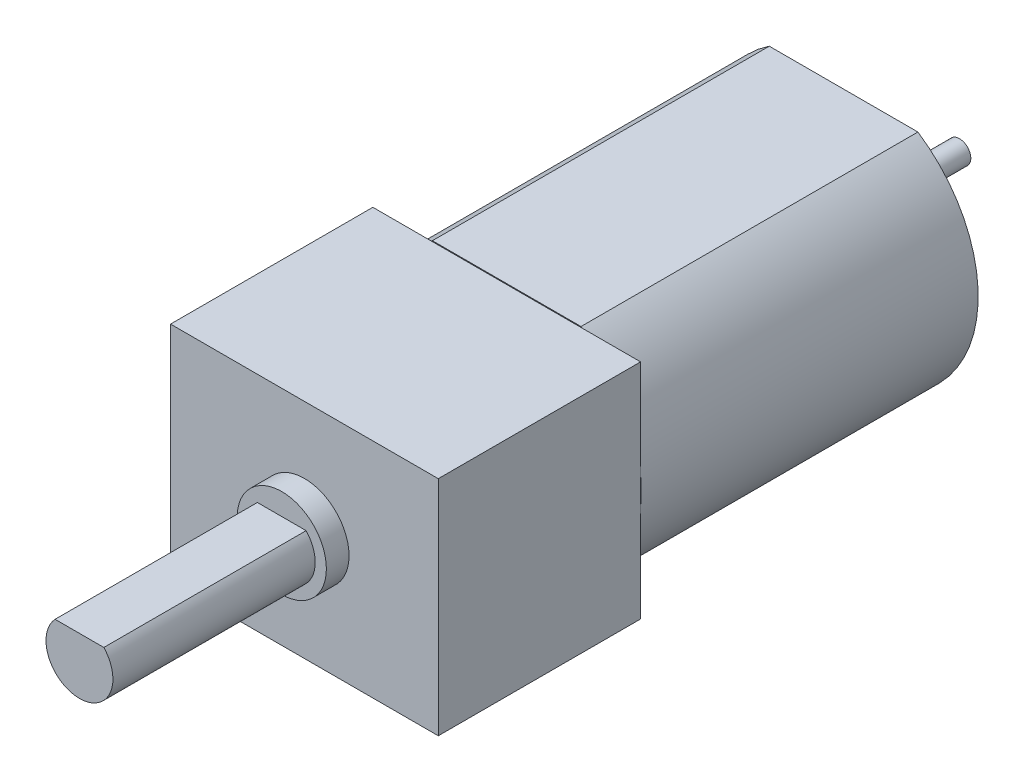
from build123d import *

# Parameters (mm, degrees)
SKETCH1_W            = 12.0015
SKETCH1_H            = 9.9822
BOSS_EXTRUDE4_DEPTH  = 9.0678
BOSS_EXTRUDE5_DEPTH  = 15.1003
SKETCH4_R            = 2.00025
BOSS_EXTRUDE9_DEPTH  = 1.016
BOSS_EXTRUDE10_DEPTH = 9.0678
SKETCH6_R            = 2.5146
BOSS_EXTRUDE11_DEPTH = 0.889
SKETCH7_R            = 0.508
BOSS_EXTRUDE12_DEPTH = 4.3053


with BuildPart() as part:
    # Sketch1 → Boss-Extrude4 (new body)
    with BuildSketch(Plane.XY):
        with Locations((11.58762082, -8.953965436)):
            Rectangle(SKETCH1_W, SKETCH1_H)
    extrude(amount=BOSS_EXTRUDE4_DEPTH)

    # Sketch3 → Boss-Extrude5 (add)
    with BuildSketch(Plane(origin=(0, 0, 0), x_dir=(-1, 0, 0), z_dir=(0, 0, -1))):
        with BuildLine():
            Line((-14.919017466, -3.924765436), (-8.256224175, -3.924765436))
            ThreePointArc((-8.256224175, -3.924765436), (-5.55512082, -8.953965436), (-8.256224175, -13.983165436))
            Line((-8.256224175, -13.983165436), (-14.919017466, -13.983165436))
            ThreePointArc((-14.919017466, -13.983165436), (-17.62012082, -8.953965436), (-14.919017466, -3.924765436))
        make_face()
    extrude(amount=BOSS_EXTRUDE5_DEPTH)

    # Sketch4 → Boss-Extrude9 (add)
    with BuildSketch(Plane.XY.offset(9.0678)):
        with Locations((11.58762082, -8.953965436)):
            Circle(SKETCH4_R)
    extrude(amount=BOSS_EXTRUDE9_DEPTH)

    # Sketch5 → Boss-Extrude10 (add)
    with BuildSketch(Plane.XY.offset(10.0838)):
        with BuildLine():
            Line((10.494618208, -7.926665436), (12.680623432, -7.926665436))
            ThreePointArc((12.680623432, -7.926665436), (11.58762082, -10.453965436), (10.494618208, -7.926665436))
        make_face()
    extrude(amount=BOSS_EXTRUDE10_DEPTH)

    # Sketch6 → Boss-Extrude11 (add)
    with BuildSketch(Plane(origin=(0, 0, -15.1003), x_dir=(-1, 0, 0), z_dir=(0, 0, -1))):
        with Locations((-11.58762082, -8.953965436)):
            Circle(SKETCH6_R)
    extrude(amount=BOSS_EXTRUDE11_DEPTH)

    # Sketch7 → Boss-Extrude12 (add)
    with BuildSketch(Plane(origin=(0, 0, -15.9893), x_dir=(-1, 0, 0), z_dir=(0, 0, -1))):
        with Locations((-11.58762082, -8.953965436)):
            Circle(SKETCH7_R)
    extrude(amount=BOSS_EXTRUDE12_DEPTH)


solid = part.part
